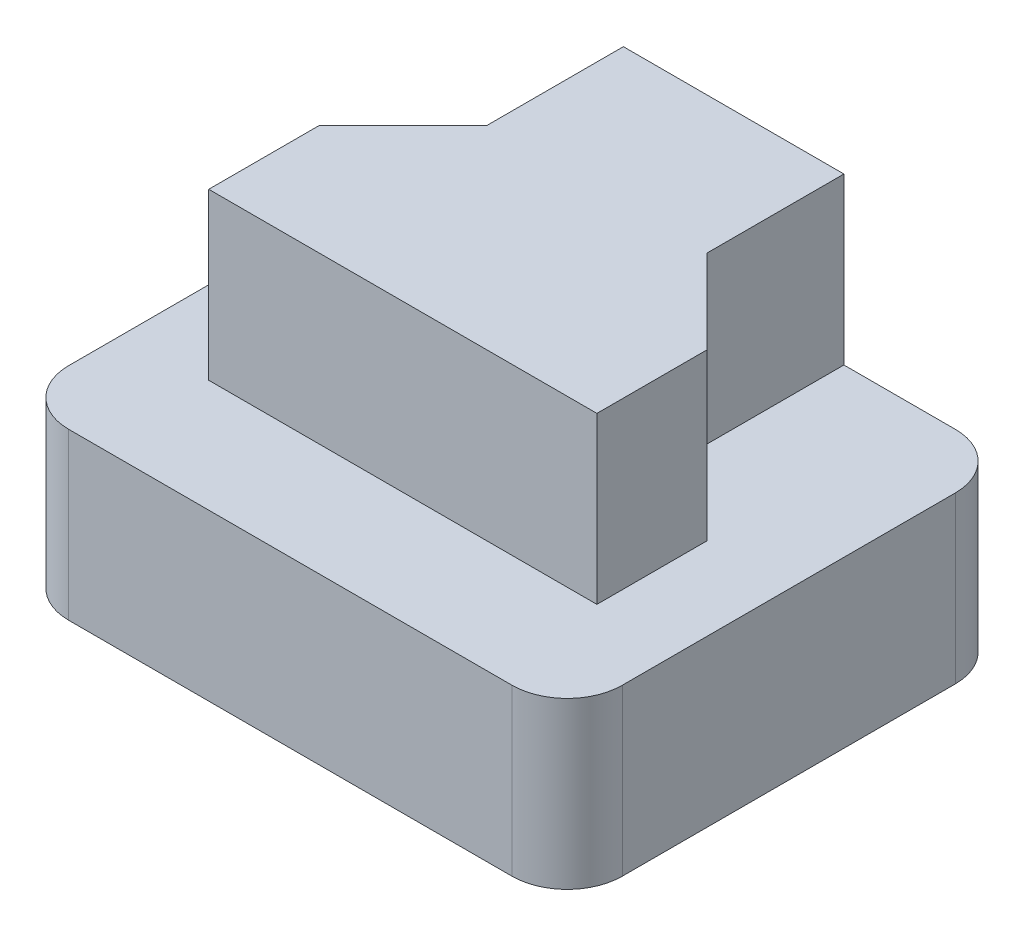
from build123d import *

# Parameters (mm, degrees)
SKETCH1_W           = 10.04
SKETCH1_H           = 8.04
BOSS_EXTRUDE1_DEPTH = 3
BOSS_EXTRUDE2_START = 3
BOSS_EXTRUDE2_DEPTH = 3
FILLET2_R           = 1


with BuildPart() as part:
    # Sketch1 → Boss-Extrude1 (new body)
    with BuildSketch(Plane(origin=(0, 0, 0), x_dir=(1, 0, 0), z_dir=(0, 1, 0))):
        Rectangle(SKETCH1_W, SKETCH1_H)
    extrude(amount=BOSS_EXTRUDE1_DEPTH)

    # Sketch1<3> → Boss-Extrude2 (add)
    with BuildSketch(Plane(origin=(0, 0, 0), x_dir=(1, 0, 0), z_dir=(0, 1, 0)).offset(BOSS_EXTRUDE2_START)):
        Polygon((-2, 0.02), (-2, 4.02), (2, 4.02), (2, 0.02), (3.52, 0.02), (3.52, -1.98), (-3.52, -1.98), (-3.52, 0.02), align=None)
        Polygon((-2, 0.02), (-2, 1.54), (-3.52, 0.02), align=None)
        Polygon((3.52, 0.02), (2, 1.54), (2, 0.02), align=None)
    extrude(amount=BOSS_EXTRUDE2_DEPTH)

    # Fillet2
    fillet2_edges = [part.edges().sort_by_distance(p)[0] for p in [
        (5.02, 1.5, -4.02),
        (-5.02, 1.5, -4.02),
        (-5.02, 1.5, 4.02),
        (5.02, 1.5, 4.02),
    ]]
    fillet(fillet2_edges, radius=FILLET2_R)


solid = part.part
